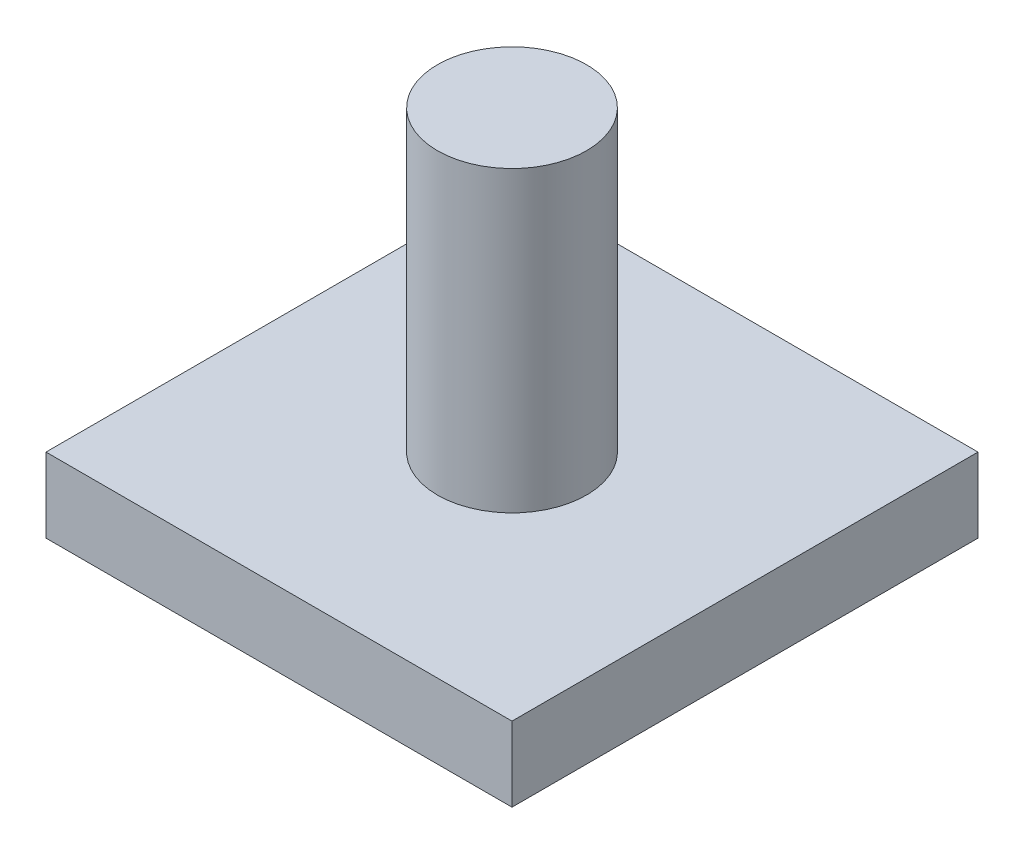
from build123d import *

# Parameters (mm, degrees)
SKETCH_1_W      = 12.5
SKETCH_1_H      = 12.5
EXTRUDE_1_DEPTH = 2
SKETCH_2_R      = 2
EXTRUDE_2_DEPTH = 8


with BuildPart() as part:
    # 草图1 → 凸台-拉伸1 (new body)
    with BuildSketch(Plane(origin=(0, 0, 0), x_dir=(1, 0, 0), z_dir=(0, 1, 0))):
        Rectangle(SKETCH_1_W, SKETCH_1_H)
    extrude(amount=EXTRUDE_1_DEPTH)

    # 草图2 → 凸台-拉伸2 (add)
    with BuildSketch(Plane(origin=(0, 2, 0), x_dir=(1, 0, 0), z_dir=(0, 1, 0))):
        with Locations(Location((0, 0, 0), (0, 0, 270))):
            Circle(SKETCH_2_R)
    extrude(amount=EXTRUDE_2_DEPTH)


solid = part.part
